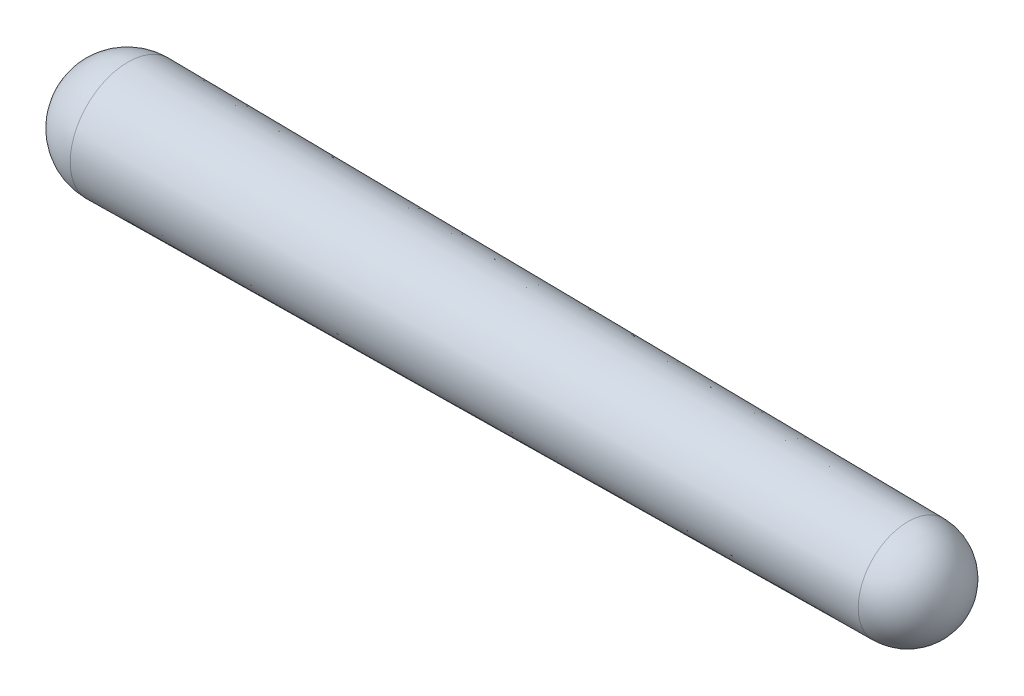
from build123d import *


with BuildPart() as part:
    # Sketch1 → Revolve1 (revolve)
    with BuildSketch(Plane.XY):
        with BuildLine():
            Line((0.0325, 3.249837496), (44.0281, 2.809859496))
            ThreePointArc((44.0281, 2.809859496), (45.996880192, 1.977010243), (46.81, 0))
            Line((46.81, 0), (-3.25, 0))
            ThreePointArc((-3.25, 0), (-2.286577683, 2.309558941), (0.0325, 3.249837496))
        make_face()
    revolve(axis=Axis((-3.25, 0, 0), (1, 0, 0)))


solid = part.part
